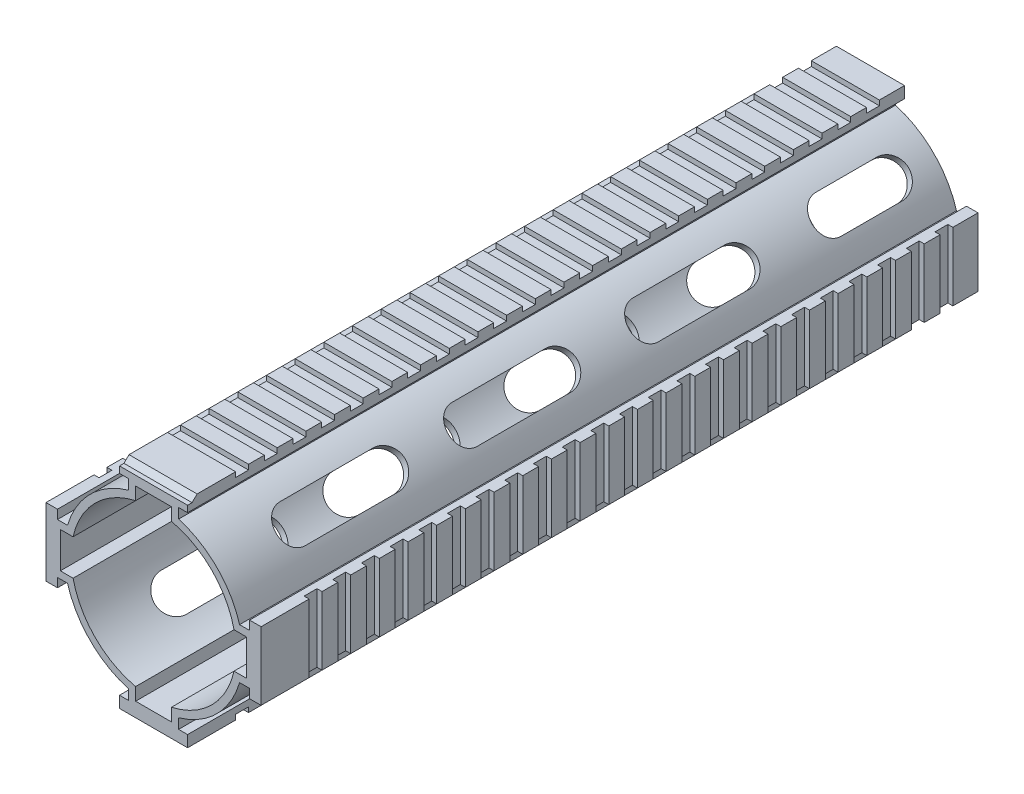
from build123d import *

# Parameters (mm, degrees)
EXTRUDE_3_DEPTH          = 200
CUT_EXTRUDE_3_DEPTH      = 200
CUT_EXTRUDE_4_DEPTH      = 210.341219976
SKETCH_9_W               = 3.6
SKETCH_9_H               = 1.4
CUT_EXTRUDE_5_DEPTH      = 205.4504831
CUT_EXTRUDE_6_DEPTH      = 205.4504831
CUT_EXTRUDE_6_DEPTH_BACK = 205.4504831
PATTERN_CIRCULAR_8_COUNT = 4


with BuildPart() as part:
    # 草图2 → 凸台-拉伸3 (new body)
    with BuildSketch(Plane.XY):
        with BuildLine():
            Line((-7, -24), (-7, -26.8))
            Line((-7, -26.8), (-9.5, -26.8))
            Line((-9.5, -26.8), (-9.5, -30))
            Line((-9.5, -30), (9.5, -30))
            Line((9.5, -30), (9.5, -26.8))
            Line((9.5, -26.8), (7, -26.8))
            Line((7, -26.8), (7, -24))
            ThreePointArc((7, -24), (17.67766953, -17.67766953), (24, -7))
            Line((24, -7), (26.8, -7))
            Line((26.8, -7), (26.8, -9.5))
            Line((26.8, -9.5), (30, -9.5))
            Line((30, -9.5), (30, 9.5))
            Line((30, 9.5), (26.8, 9.5))
            Line((26.8, 9.5), (26.8, 7))
            Line((26.8, 7), (24, 7))
            ThreePointArc((24, 7), (17.67766953, 17.67766953), (7, 24))
            Line((7, 24), (7, 26.8))
            Line((7, 26.8), (9.5, 26.8))
            Line((9.5, 26.8), (9.5, 30))
            Line((9.5, 30), (-9.5, 30))
            Line((-9.5, 30), (-9.5, 26.8))
            Line((-9.5, 26.8), (-7, 26.8))
            Line((-7, 26.8), (-7, 24))
            ThreePointArc((-7, 24), (-17.67766953, 17.67766953), (-24, 7))
            Line((-24, 7), (-26.8, 7))
            Line((-26.8, 7), (-26.8, 9.5))
            Line((-26.8, 9.5), (-30, 9.5))
            Line((-30, 9.5), (-30, -9.5))
            Line((-30, -9.5), (-26.8, -9.5))
            Line((-26.8, -9.5), (-26.8, -7))
            Line((-26.8, -7), (-24, -7))
            ThreePointArc((-24, -7), (-17.67766953, -17.67766953), (-7, -24))
        make_face()
    extrude(amount=EXTRUDE_3_DEPTH)

    # 草图1 → 切除-拉伸3 (cut)
    with BuildSketch(Plane.XY):
        with BuildLine():
            Line((-5, -22.449944321), (-5, -26))
            Line((-5, -26), (5, -26))
            Line((5, -26), (5, -22.449944321))
            ThreePointArc((5, -22.449944321), (16.263455967, -16.263455967), (22.449944321, -5))
            Line((22.449944321, -5), (26, -5))
            Line((26, -5), (26, 5))
            Line((26, 5), (22.449944321, 5))
            ThreePointArc((22.449944321, 5), (16.263455967, 16.263455967), (5, 22.449944321))
            Line((5, 22.449944321), (5, 26))
            Line((5, 26), (-5, 26))
            Line((-5, 26), (-5, 22.449944321))
            ThreePointArc((-5, 22.449944321), (-16.263455967, 16.263455967), (-22.449944321, 5))
            Line((-22.449944321, 5), (-26, 5))
            Line((-26, 5), (-26, -5))
            Line((-26, -5), (-22.449944321, -5))
            ThreePointArc((-22.449944321, -5), (-16.263455967, -16.263455967), (-5, -22.449944321))
        make_face()
    extrude(amount=CUT_EXTRUDE_3_DEPTH, mode=Mode.SUBTRACT)

    # 草图5 → 切除-拉伸4 (cut, symmetric)
    with BuildSketch(Plane(origin=(13.72497216, -13.72497216, 0), x_dir=(-0.7071067811865503, -0.7071067811865447, 0), z_dir=(0.7071067811865447, -0.7071067811865503, 0))):
        with BuildLine():
            Line((5, -12), (5, -29))
            ThreePointArc((5, -29), (0, -34), (-5, -29))
            Line((-5, -29), (-5, -12))
            ThreePointArc((-5, -12), (0, -7), (5, -12))
        make_face()
        with BuildLine():
            Line((5, -54.5), (5, -80))
            ThreePointArc((5, -80), (0, -85), (-5, -80))
            Line((-5, -80), (-5, -54.5))
            ThreePointArc((-5, -54.5), (0, -49.5), (5, -54.5))
        make_face()
        with BuildLine():
            Line((5, -104.5), (5, -130.5))
            ThreePointArc((5, -130.5), (0, -135.5), (-5, -130.5))
            Line((-5, -130.5), (-5, -104.5))
            ThreePointArc((-5, -104.5), (0, -99.5), (5, -104.5))
        make_face()
        with BuildLine():
            Line((5, -152.5), (5, -178.5))
            ThreePointArc((5, -178.5), (0, -183.5), (-5, -178.5))
            Line((-5, -178.5), (-5, -152.5))
            ThreePointArc((-5, -152.5), (0, -147.5), (5, -152.5))
        make_face()
    cut_extrude_4 = extrude(amount=CUT_EXTRUDE_4_DEPTH, both=True, mode=Mode.SUBTRACT)

    # 草图9 → 切除-拉伸5 (cut, symmetric)
    with BuildSketch(Plane(origin=(0, 0, 0), x_dir=(0, 0, -1), z_dir=(1, 0, 0))):
        with Locations((-8.8, 29.3)):
            Rectangle(SKETCH_9_W, SKETCH_9_H)
        with Locations((-16.8, 29.3)):
            Rectangle(SKETCH_9_W, SKETCH_9_H)
        with Locations((-24.8, 29.3)):
            Rectangle(SKETCH_9_W, SKETCH_9_H)
        with Locations((-32.8, 29.3)):
            Rectangle(SKETCH_9_W, SKETCH_9_H)
        with Locations((-40.8, 29.3)):
            Rectangle(SKETCH_9_W, SKETCH_9_H)
        with Locations((-48.8, 29.3)):
            Rectangle(SKETCH_9_W, SKETCH_9_H)
        with Locations((-56.8, 29.3)):
            Rectangle(SKETCH_9_W, SKETCH_9_H)
        with Locations((-64.8, 29.3)):
            Rectangle(SKETCH_9_W, SKETCH_9_H)
        with Locations((-72.8, 29.3)):
            Rectangle(SKETCH_9_W, SKETCH_9_H)
        with Locations((-80.8, 29.3)):
            Rectangle(SKETCH_9_W, SKETCH_9_H)
        with Locations((-88.8, 29.3)):
            Rectangle(SKETCH_9_W, SKETCH_9_H)
        with Locations((-96.8, 29.3)):
            Rectangle(SKETCH_9_W, SKETCH_9_H)
        with Locations((-104.8, 29.3)):
            Rectangle(SKETCH_9_W, SKETCH_9_H)
        with Locations((-112.8, 29.3)):
            Rectangle(SKETCH_9_W, SKETCH_9_H)
        with Locations((-120.8, 29.3)):
            Rectangle(SKETCH_9_W, SKETCH_9_H)
        with Locations((-128.8, 29.3)):
            Rectangle(SKETCH_9_W, SKETCH_9_H)
        with Locations((-136.8, 29.3)):
            Rectangle(SKETCH_9_W, SKETCH_9_H)
        with Locations((-144.8, 29.3)):
            Rectangle(SKETCH_9_W, SKETCH_9_H)
        with Locations((-152.8, 29.3)):
            Rectangle(SKETCH_9_W, SKETCH_9_H)
        with Locations((-160.8, 29.3)):
            Rectangle(SKETCH_9_W, SKETCH_9_H)
        with Locations((-168.8, 29.3)):
            Rectangle(SKETCH_9_W, SKETCH_9_H)
        with Locations((-176.8, 29.3)):
            Rectangle(SKETCH_9_W, SKETCH_9_H)
        with Locations((-184.8, 29.3)):
            Rectangle(SKETCH_9_W, SKETCH_9_H)
    cut_extrude_5 = extrude(amount=CUT_EXTRUDE_5_DEPTH, both=True, mode=Mode.SUBTRACT)

    # 草图10 → 切除-拉伸6 (cut, two sides: drawn at the far end of the back side and taken through both)
    with BuildSketch(Plane(origin=(0, 0, 0), x_dir=(0, 0, -1), z_dir=(1, 0, 0)).offset(-CUT_EXTRUDE_6_DEPTH_BACK)):
        Polygon((-200, 28.6), (-198.75, 28.6), (-197.35, 30), (-200, 30), align=None)
    extrude(amount=CUT_EXTRUDE_6_DEPTH + CUT_EXTRUDE_6_DEPTH_BACK, mode=Mode.SUBTRACT)

    # 阵列(圆周)8: 切除-拉伸4, 切除-拉伸5 ×4 about axis
    pattern_circular_8_axis = Axis((0, 0, 0), (0, 0, 1))
    add([cut_extrude_4.rotate(pattern_circular_8_axis, i * 360 / PATTERN_CIRCULAR_8_COUNT) for i in range(1, PATTERN_CIRCULAR_8_COUNT)], mode=Mode.SUBTRACT)
    add([cut_extrude_5.rotate(pattern_circular_8_axis, i * 360 / PATTERN_CIRCULAR_8_COUNT) for i in range(1, PATTERN_CIRCULAR_8_COUNT)], mode=Mode.SUBTRACT)


solid = part.part
